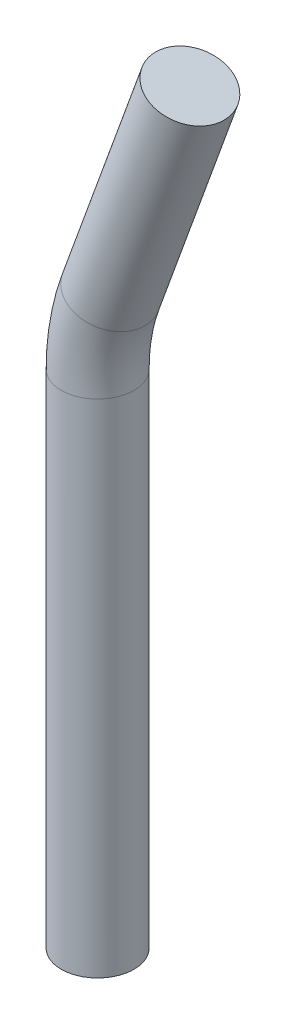
from build123d import *

# Parameters (mm, degrees)
SKETCH2_R = 6.75


with BuildPart() as part:
    # Sweep1: sweep along a path in Sketch1
    with BuildLine(Plane.XY) as sweep1_path:
        Line((0, 0), (0, 92.946920772))
        ThreePointArc((0, 92.946920772), (0.60768988, 99.892847878), (2.412295169, 106.627726505))
        Line((2.412295169, 106.627726505), (17.101007166, 146.984631039))
    # Sketch2 → Sweep1 (sweep)
    with BuildSketch(Plane(origin=(0, 0, 0), x_dir=(1, 0, 0), z_dir=(0, 1, 0))):
        Circle(SKETCH2_R)
    sweep(path=sweep1_path.line)


solid = part.part
